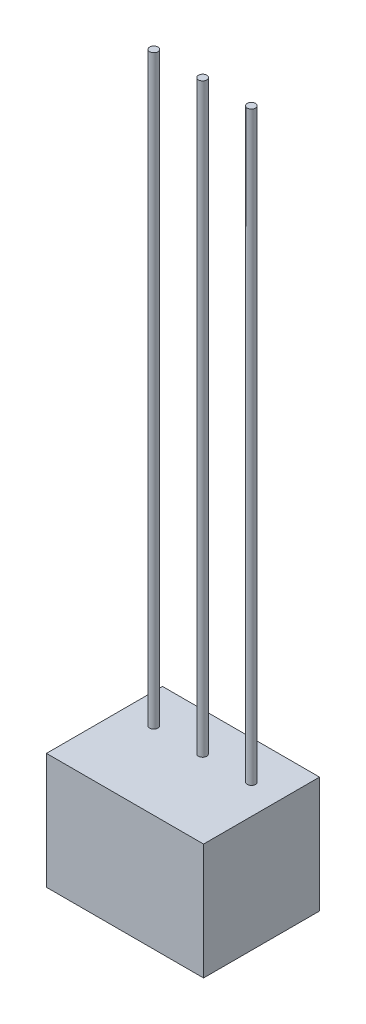
from build123d import *

# Parameters (mm, degrees)
SKETCH1_W           = 4.09
SKETCH1_H           = 3.02
BOSS_EXTRUDE1_DEPTH = 3.02
SKETCH2_R           = 0.1075
BOSS_EXTRUDE2_DEPTH = 15.25


with BuildPart() as part:
    # Sketch1 → Boss-Extrude1 (new body)
    with BuildSketch(Plane.XY):
        with Locations((2.045, 1.51)):
            Rectangle(SKETCH1_W, SKETCH1_H)
    extrude(amount=BOSS_EXTRUDE1_DEPTH)

    # Sketch2 → Boss-Extrude2 (add)
    with BuildSketch(Plane(origin=(0, 3.02, 0), x_dir=(1, 0, 0), z_dir=(0, 1, 0))):
        with Locations(Location((0.775, -1, 0), (0, 0, 270))):
            Circle(SKETCH2_R)
        with Locations(Location((2.045, -1, 0), (0, 0, 270))):
            Circle(SKETCH2_R)
        with Locations(Location((3.315, -1, 0), (0, 0, 270))):
            Circle(SKETCH2_R)
    extrude(amount=BOSS_EXTRUDE2_DEPTH)


solid = part.part
